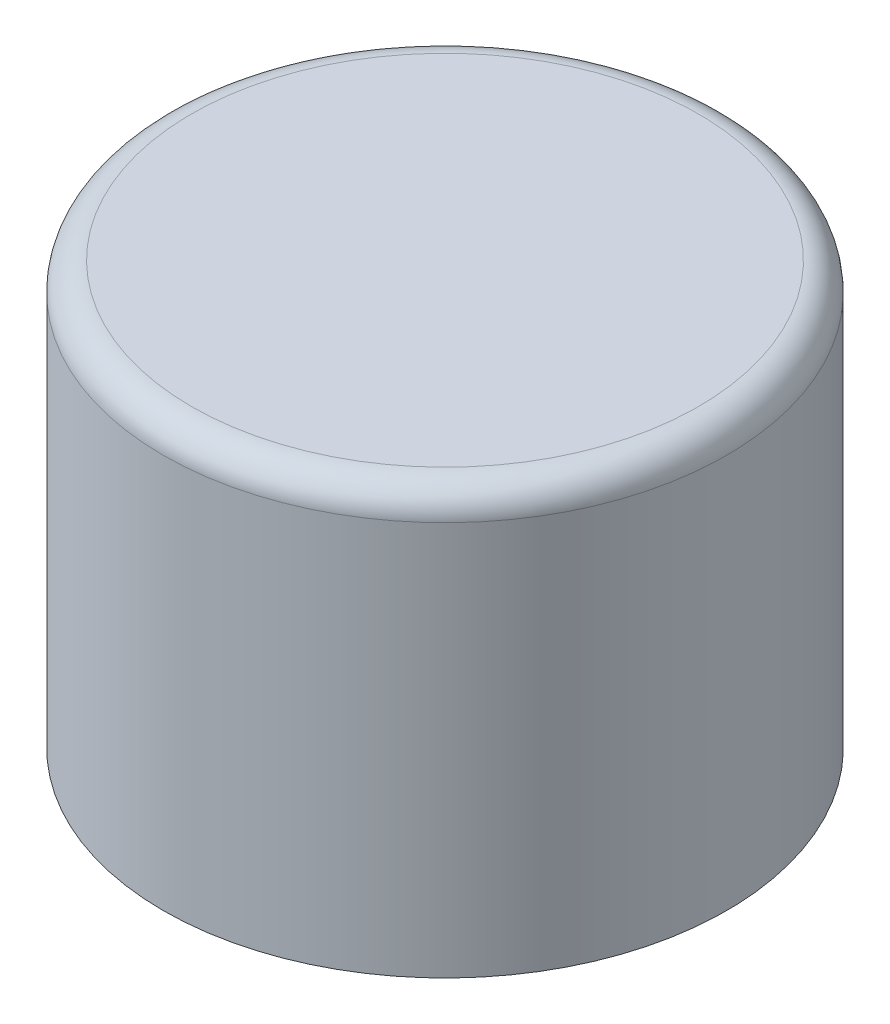
from build123d import *

# Parameters (mm, degrees)
FILLET1_R = 1


with BuildPart() as part:
    # Sketch1 → Revolve1 (revolve)
    with BuildSketch(Plane(origin=(0, 0, 0), x_dir=(0, 0, -1), z_dir=(1, 0, 0))):
        Polygon((9, 0), (9, 12.5), (4, 12.5), (4, 8.5), (2.5, 8.5), (2.5, 12.5), (0, 12.5), (0, 15), (10, 15), (10, 0), align=None)
    revolve(axis=Axis((0, 0, 0), (0, 1, 0)))

    # Fillet1
    fillet1_edges = [part.edges().sort_by_distance(p)[0] for p in [
        (0, 15, 10),
    ]]
    fillet(fillet1_edges, radius=FILLET1_R)


solid = part.part
